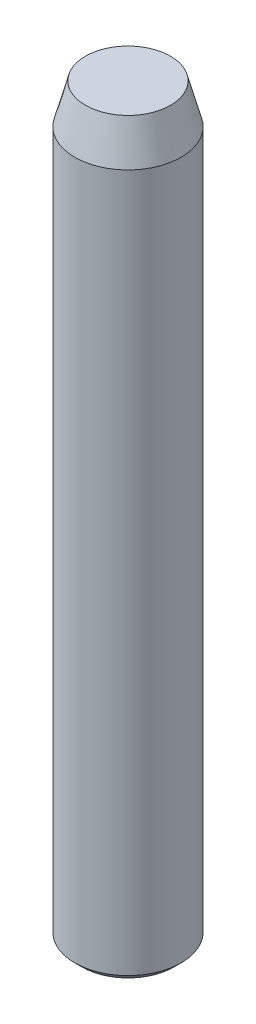
from build123d import *

# Parameters (mm, degrees)
SKETCH1_R           = 15
BOSS_EXTRUDE1_DEPTH = 210
CHAMFER1_SIZE       = 2
CHAMFER2_SIZE       = 3
CHAMFER2_SIZE2      = 11.196152423


with BuildPart() as part:
    # Sketch1 → Boss-Extrude1 (new body)
    with BuildSketch(Plane(origin=(0, 0, 0), x_dir=(1, 0, 0), z_dir=(0, 1, 0))):
        with Locations(Location((0, 0, 0), (0, 0, 270))):
            Circle(SKETCH1_R)
    extrude(amount=-BOSS_EXTRUDE1_DEPTH)

    # Chamfer1
    chamfer1_edges = [part.edges().sort_by_distance(p)[0] for p in [
        (0, -210, -15),
    ]]
    chamfer(chamfer1_edges, length=CHAMFER1_SIZE)

    # Chamfer2
    chamfer2_edges = [part.edges().sort_by_distance(p)[0] for p in [
        (0, 0, -15),
    ]]
    chamfer2_side = [part.faces().sort_by_distance(p)[0] for p in [
        (0, 0, 0),
    ]]
    chamfer(chamfer2_edges, length=CHAMFER2_SIZE, length2=CHAMFER2_SIZE2, reference=chamfer2_side[0])


solid = part.part
